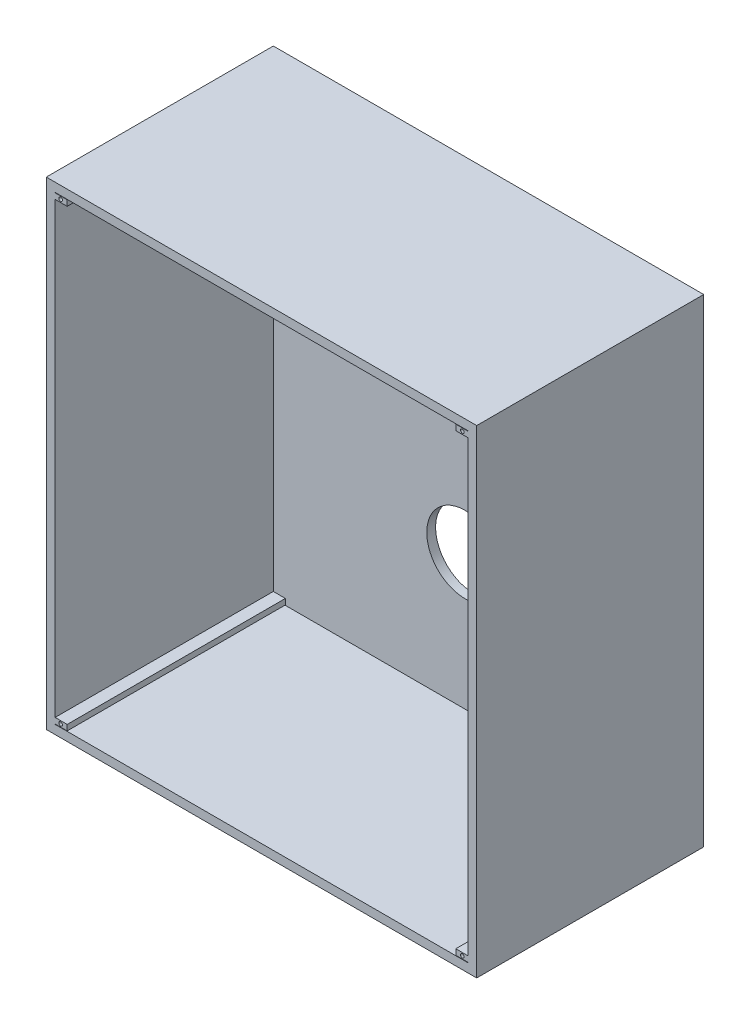
from build123d import *

# Parameters (mm, degrees)
SKETCH1_W           = 123.619311202
SKETCH1_H           = 65.206161616
BOSS_EXTRUDE1_DEPTH = 137.414
SHELL1_T            = -2.54
SKETCH2_R           = 3.216585951
SKETCH2_R_2         = 6.694232597
SKETCH2_R_3         = 10.992771438
CUT_EXTRUDE1_DEPTH  = 137.414
SKETCH3_W           = 3.463459185
SKETCH3_H           = 1.622403572
BOSS_EXTRUDE2_DEPTH = 62.666161616
SKETCH4_R           = 0.525209506
CUT_EXTRUDE2_DEPTH  = 10.668


with BuildPart() as part:
    # Sketch1 → Boss-Extrude1 (new body)
    with BuildSketch(Plane(origin=(0, 0, 0), x_dir=(1, 0, 0), z_dir=(0, 1, 0))):
        Rectangle(SKETCH1_W, SKETCH1_H)
    extrude(amount=BOSS_EXTRUDE1_DEPTH)

    # Shell1
    shell1_openings = [part.faces().sort_by_distance(p)[0] for p in [
        (0, 68.707, 32.603080808),
    ]]
    offset(amount=SHELL1_T, openings=shell1_openings, kind=Kind.INTERSECTION)

    # Sketch2 → Cut-Extrude1 (cut)
    with BuildSketch(Plane(origin=(0, 0, -32.603080808), x_dir=(-1, 0, 0), z_dir=(0, 0, -1))):
        with Locations((-42.982548284, 126.151721485)):
            Circle(SKETCH2_R)
        with Locations((-17.693943749, 108.296189209)):
            Circle(SKETCH2_R_2)
        with Locations((4.201301712, 96.419432446)):
            Circle(SKETCH2_R_3)
        with Locations(Location((4.201301712, 40.994567554, 0), (0, 0, 180))):
            Circle(SKETCH2_R_3)
        with Locations(Location((-17.693943749, 29.117810791, 0), (0, 0, 180))):
            Circle(SKETCH2_R_2)
        with Locations(Location((-42.982548284, 11.262278515, 0), (0, 0, 180))):
            Circle(SKETCH2_R)
    extrude(amount=-CUT_EXTRUDE1_DEPTH, mode=Mode.SUBTRACT)

    # Sketch3 → Boss-Extrude2 (add)
    with BuildSketch(Plane.XY.offset(-30.063080808)):
        with Locations((57.537926009, 133.950956633)):
            Rectangle(SKETCH3_W, SKETCH3_H)
        with Locations((-57.537926009, 133.950956633)):
            Rectangle(SKETCH3_W, SKETCH3_H)
        with Locations((-57.537926009, 3.463043367)):
            Rectangle(SKETCH3_W, SKETCH3_H)
        with Locations((57.537926009, 3.463043367)):
            Rectangle(SKETCH3_W, SKETCH3_H)
    extrude(amount=BOSS_EXTRUDE2_DEPTH)

    # Sketch4 → Cut-Extrude2 (cut)
    with BuildSketch(Plane.XY.offset(32.603080808)):
        with Locations((57.694217547, 133.960377278)):
            Circle(SKETCH4_R)
        with Locations(Location((-57.694217547, 133.960377278, 0), (0, 0, 180))):
            Circle(SKETCH4_R)
        with Locations(Location((57.694217547, 3.453622722, 0), (0, 0, 180))):
            Circle(SKETCH4_R)
        with Locations((-57.694217547, 3.453622722)):
            Circle(SKETCH4_R)
    extrude(amount=-CUT_EXTRUDE2_DEPTH, mode=Mode.SUBTRACT)


solid = part.part
